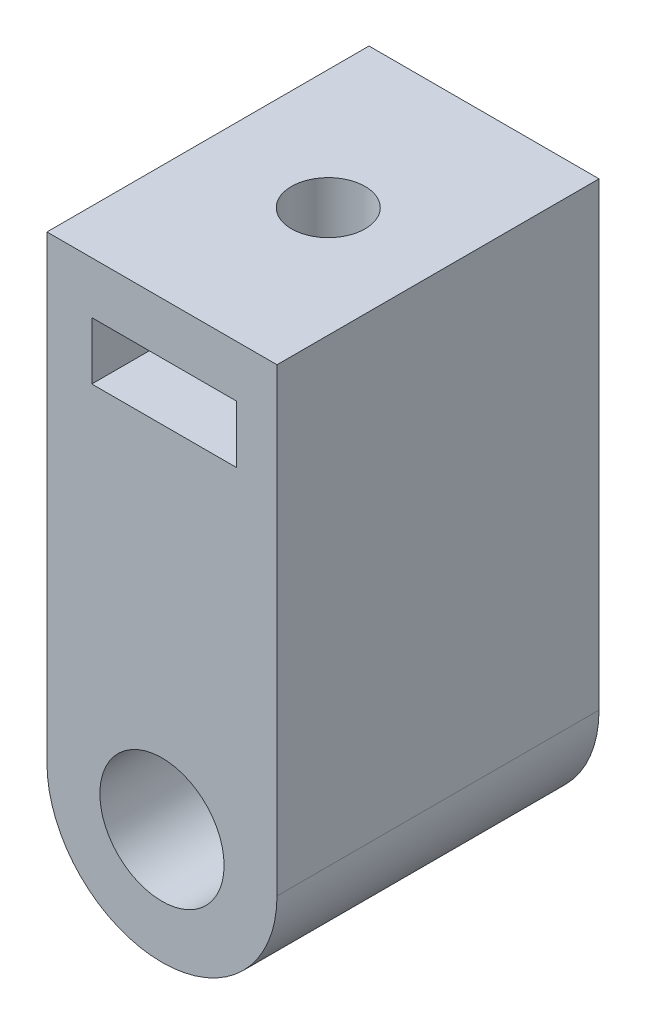
from build123d import *

# Parameters (mm, degrees)
SKETCH_1_R          = 5
SKETCH_1_R_2        = 2.7
EXTRUDE_1_DEPTH     = 14
EXTRUDE_START       = -14
EXTRUDE_2_DEPTH     = 14
SKETCH_5_W          = 6.3
SKETCH_5_H          = 2.5
CUT_EXTRUDE_3_DEPTH = 10
SKETCH_10_W         = 11.05826702
SKETCH_10_H         = 10.05
CUT_EXTRUDE_5_DEPTH = 9.4
SKETCH_12_R         = 1.6
CUT_EXTRUDE_7_DEPTH = 23.639691363


with BuildPart() as part:
    # Эскиз1 → Бобышка-Вытянуть1 (new body)
    with BuildSketch(Plane.XY):
        Circle(SKETCH_1_R)
        Circle(SKETCH_1_R_2, mode=Mode.SUBTRACT)
    extrude(amount=EXTRUDE_1_DEPTH)

    # Эскиз2 → Бобышка-Вытянуть2 (add)
    with BuildSketch(Plane.XY.offset(14).offset(EXTRUDE_START)):
        with BuildLine():
            Line((-5, 0), (-2.7, 0))
            ThreePointArc((-2.7, 0), (0, 2.7), (2.7, 0))
            Line((2.7, 0), (5, 0))
            Line((5, 0), (5, 20))
            Line((5, 20), (-5, 20))
            Line((-5, 20), (-5, 0))
        make_face()
    extrude(amount=EXTRUDE_2_DEPTH)

    # Эскиз5 → Вырез-Вытянуть3 (cut)
    with BuildSketch(Plane.XY.offset(14)):
        with Locations((0.1, 16.5)):
            Rectangle(SKETCH_5_W, SKETCH_5_H)
    extrude(amount=-CUT_EXTRUDE_3_DEPTH, mode=Mode.SUBTRACT)

    # Эскиз10 → Вырез-Вытянуть5 (cut)
    with BuildSketch(Plane.ZY.offset(5)):
        with Locations((6.97086649, 7.95)):
            Rectangle(SKETCH_10_W, SKETCH_10_H)
    extrude(amount=-CUT_EXTRUDE_5_DEPTH, mode=Mode.SUBTRACT)

    # Эскиз12 → Вырез-Вытянуть7 (cut, through all)
    with BuildSketch(Plane(origin=(0, 2.925, 0), x_dir=(1, 0, 0), z_dir=(0, 1, 0))):
        with Locations(Location((0.19946897, -6.97086649, 0), (0, 0, 90))):
            Circle(SKETCH_12_R)
    extrude(amount=CUT_EXTRUDE_7_DEPTH, mode=Mode.SUBTRACT)


solid = part.part
